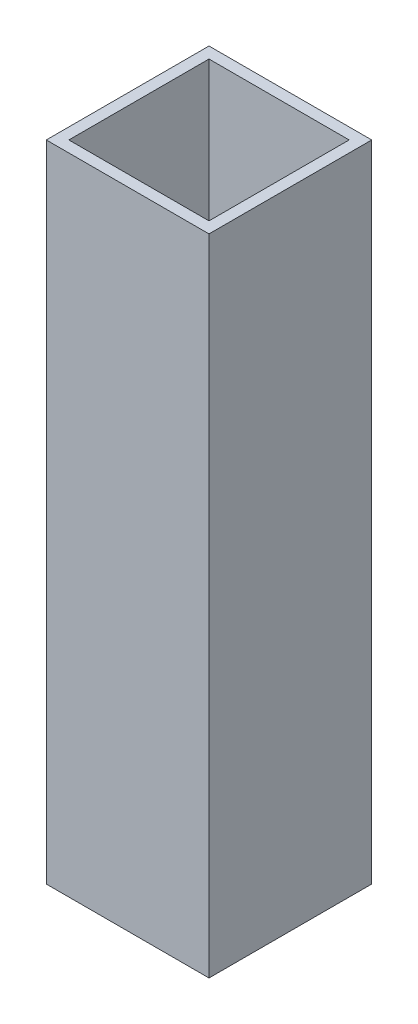
from build123d import *

# Parameters (mm, degrees)
SKETCH1_W           = 25.654
SKETCH1_H           = 25.654
SKETCH1_W_2         = 22.098
SKETCH1_H_2         = 22.098
BOSS_EXTRUDE1_DEPTH = 101.6


with BuildPart() as part:
    # Sketch1 → Boss-Extrude1 (new body)
    with BuildSketch(Plane(origin=(0, 0, 0), x_dir=(1, 0, 0), z_dir=(0, 1, 0))):
        Rectangle(SKETCH1_W, SKETCH1_H)
        Rectangle(SKETCH1_W_2, SKETCH1_H_2, mode=Mode.SUBTRACT)
    extrude(amount=BOSS_EXTRUDE1_DEPTH)


solid = part.part
